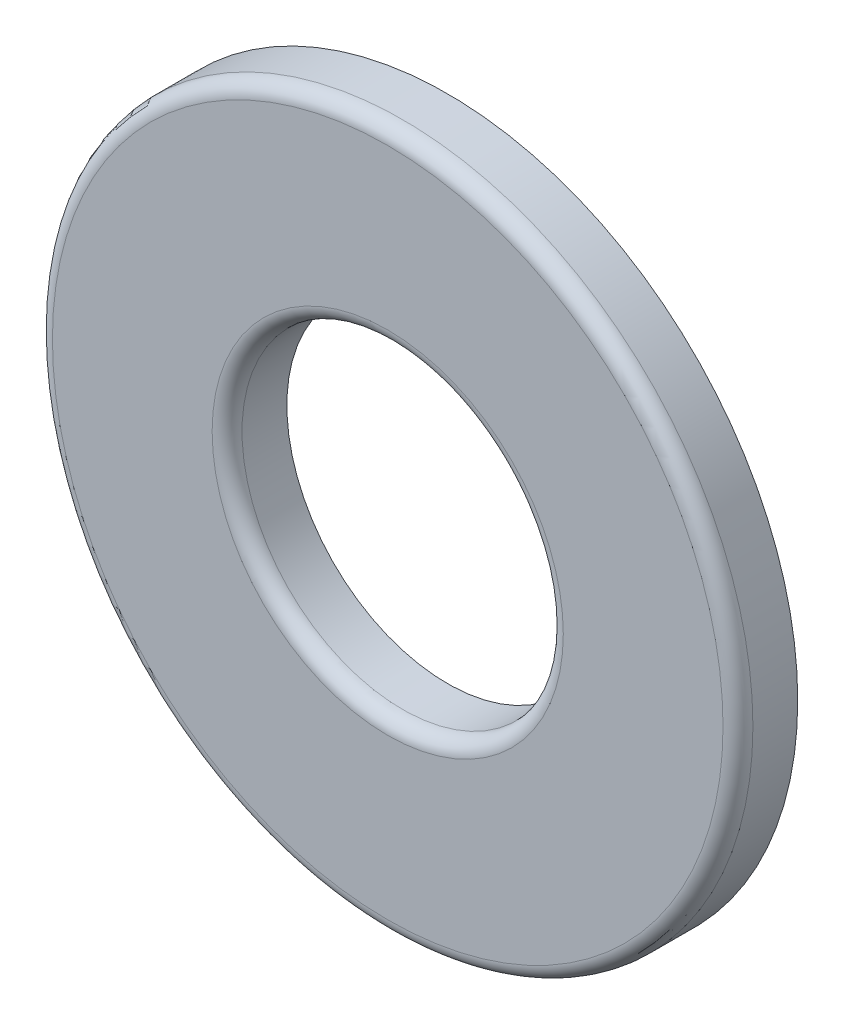
from build123d import *

# Parameters (mm, degrees)
BOSS_EXTRUDE1_DEPTH      = 0.4064
BOSS_EXTRUDE1_DEPTH_BACK = 0.4064
SKETCH3_R                = 4.7625
SKETCH3_R_2              = 2.1844
FILLET1_R                = 0.2032


with BuildPart() as part:
    # Sketch3 → Boss-Extrude1 (new, two sides: drawn at the far end of the back side and taken through both)
    with BuildSketch(Plane.XY.offset(-BOSS_EXTRUDE1_DEPTH_BACK)):
        Circle(SKETCH3_R)
        Circle(SKETCH3_R_2, mode=Mode.SUBTRACT)
    extrude(amount=BOSS_EXTRUDE1_DEPTH + BOSS_EXTRUDE1_DEPTH_BACK)

    # Fillet1
    fillet1_edges = [part.edges().sort_by_distance(p)[0] for p in [
        (-4.7625, 0, 0.4064),
        (-2.1844, 0, 0.4064),
    ]]
    fillet(fillet1_edges, radius=FILLET1_R)


solid = part.part
